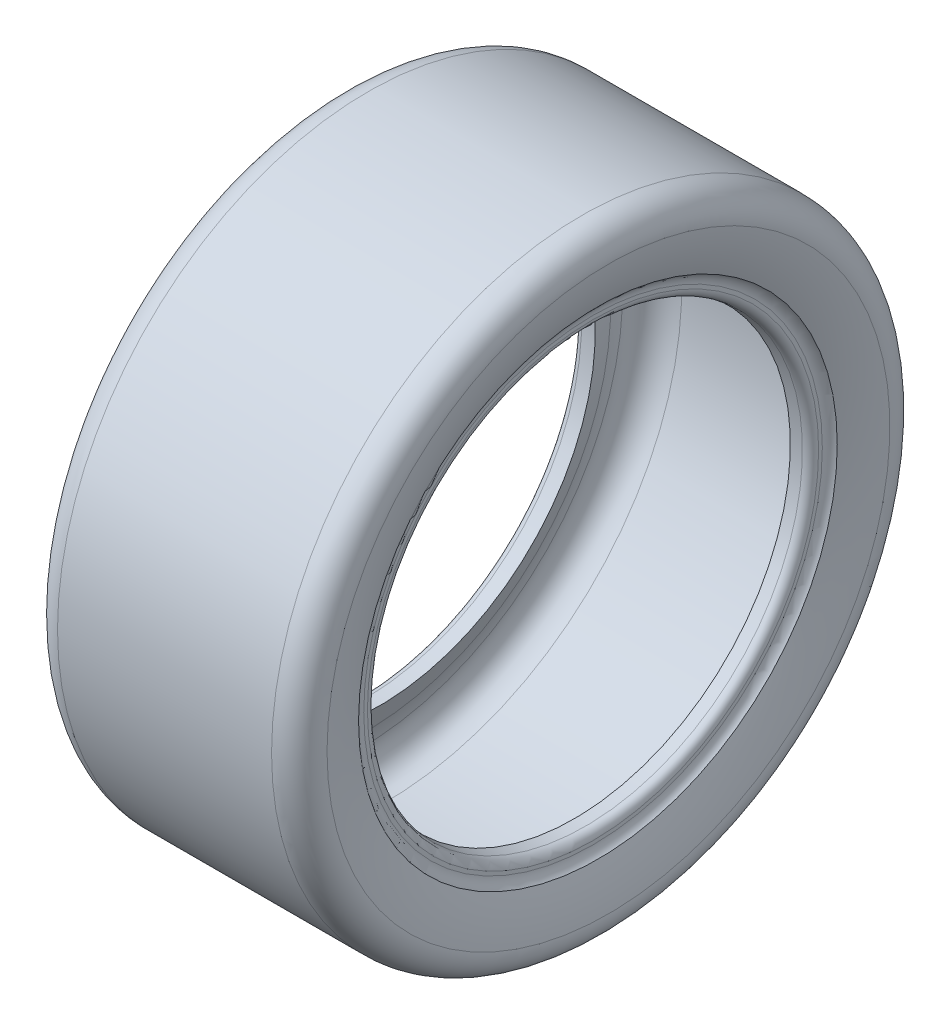
from build123d import *


with BuildPart() as part:
    # Sketch1 → Revolve1 (revolve)
    with BuildSketch(Plane(origin=(0, 0, 0), x_dir=(-1, 0, 0), z_dir=(0, 0, -1)), mode=Mode.PRIVATE) as revolve1_sk:
        with BuildLine():
            Line((-99.341971214, 225), (38.49054089, 225))
            ThreePointArc((38.49054089, 225), (54.453566459, 217.049141658), (57.724616527, 199.51818147))
            ThreePointArc((57.724616527, 199.51818147), (55.320067435, 192.183736475), (52.349083073, 185.059889788))
            Line((52.349083073, 185.059889788), (42.275550867, 163.34046617))
            add(Edge.make_bspline(
                [(42.275550867, 163.34046617), (46.038235273, 163.642360166), (49.797455181, 163.984882127), (53.557808206, 164.313870387)],
                knots=[0, 0, 0, 0, 1, 1, 1, 1], degree=3))
            ThreePointArc((53.557808206, 164.313870387), (57.71858647, 166.365739157), (59.400011539, 170.68951655))
            add(Edge.make_bspline(
                [(59.400011539, 170.68951655), (59.400011539, 172.101722208), (59.40001154, 173.513927866), (59.40001154, 174.926133525)],
                knots=[0, 0, 0, 0, 1, 1, 1, 1], degree=3))
            add(Edge.make_bspline(
                [(59.40001154, 174.926133525), (59.405021402, 175.107032476), (59.409889033, 175.284384181), (59.414617396, 175.458242786)],
                knots=[0, 0, 0, 0, 1, 1, 1, 1], degree=3))
            add(Edge.make_bspline(
                [(59.414617396, 175.458242786), (59.482082111, 175.960963787), (59.549546825, 176.463684788), (59.61701154, 176.966405789)],
                knots=[0, 0, 0, 0, 1, 1, 1, 1], degree=3))
            add(Edge.make_bspline(
                [(59.61701154, 176.966405789), (59.916669997, 177.734480247), (60.541497009, 179.755797869), (61.42101154, 180.852739441)],
                knots=[0, 0, 0, 0, 1, 1, 1, 1], degree=3))
            ThreePointArc((61.42101154, 180.852739441), (67.197385684, 196.275653178), (70.574825466, 212.394761929))
            ThreePointArc((70.574825466, 212.394761929), (65.780271504, 228.188920323), (50.74523307, 235))
            Line((50.74523307, 235), (-111.174497648, 235))
            ThreePointArc((-111.174497648, 235), (-126.035436417, 228.384786098), (-131.065546312, 212.915249889))
            ThreePointArc((-131.065546312, 212.915249889), (-128.199586868, 196.716271297), (-123.079852775, 181.082687135))
            ThreePointArc((-123.079852775, 181.082687135), (-120.368300941, 177.701518602), (-119.40001154, 173.476920439))
            add(Edge.make_bspline(
                [(-119.40001154, 173.476920439), (-119.40001154, 172.547785809), (-119.400011539, 171.61865118), (-119.400011539, 170.68951655)],
                knots=[0, 0, 0, 0, 1, 1, 1, 1], degree=3))
            ThreePointArc((-119.400011539, 170.68951655), (-117.718586469, 166.365739157), (-113.557808205, 164.313870387))
            Line((-113.557808205, 164.313870387), (-105.143092091, 163.57767812))
            Line((-105.143092091, 163.57767812), (-113.819998649, 184.858280015))
            ThreePointArc((-113.819998649, 184.858280015), (-116.605065425, 192.51440711), (-118.796544816, 200.361081381))
            ThreePointArc((-118.796544816, 200.361081381), (-115.038760255, 217.393982968), (-99.341971214, 225))
        make_face()
    revolve(revolve1_sk.sketch.rotate(Axis((131.174497648, 0, 0), (-1, 0, 0)), 270), axis=Axis((131.174497648, 0, 0), (-1, 0, 0)))


solid = part.part
